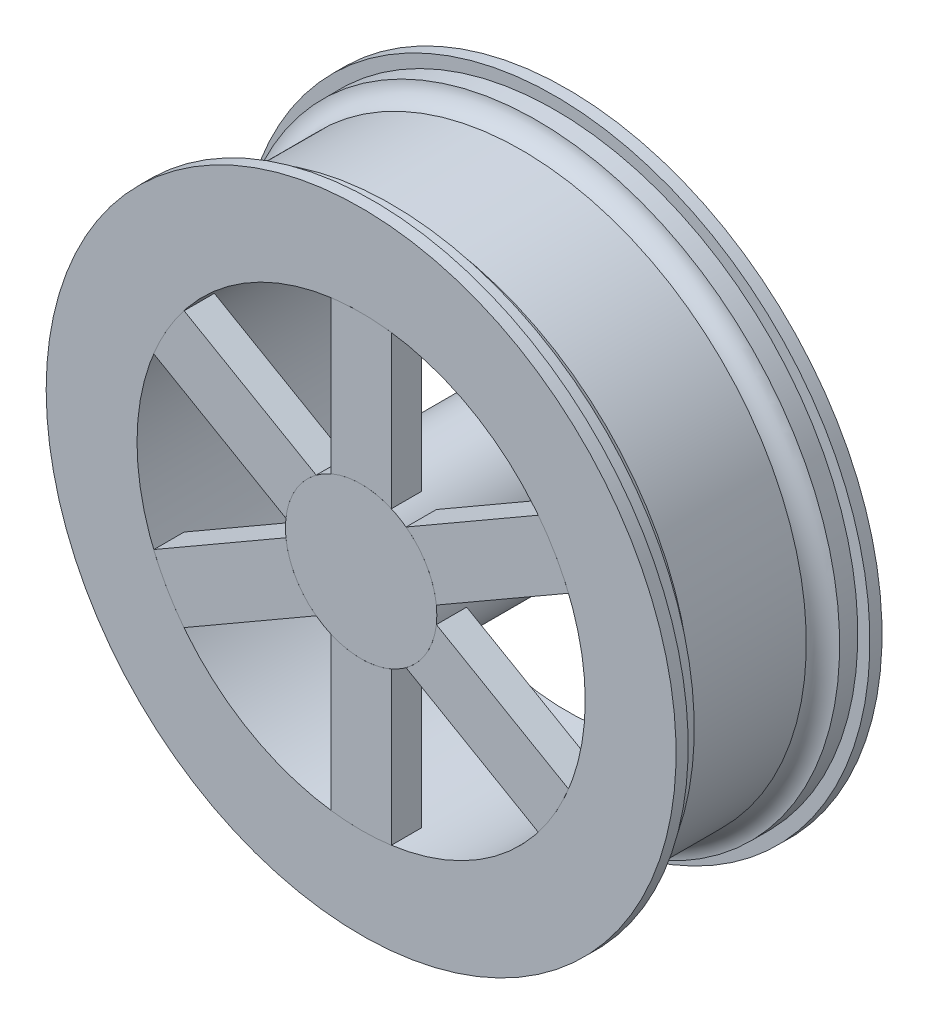
from build123d import *

# Parameters (mm, degrees)
SKETCH2_R             = 12.5
SKETCH2_R_2           = 7.5
BOSS_EXTRUDE1_DEPTH   = 45
BOSS_EXTRUDE6_DEPTH   = 5
BOSS_EXTRUDE6_2_DEPTH = 5
BOSS_EXTRUDE6_3_DEPTH = 5
BOSS_EXTRUDE6_4_DEPTH = 5
BOSS_EXTRUDE6_5_DEPTH = 5
BOSS_EXTRUDE6_6_DEPTH = 5
CUT_EXTRUDE1_DEPTH    = 40


with BuildPart() as part:
    # Sketch1 → Revolve1 (revolve)
    with BuildSketch(Plane(origin=(0, 0, 0), x_dir=(0, 0, -1), z_dir=(1, 0, 0)), mode=Mode.PRIVATE) as revolve1_sk:
        with BuildLine():
            Line((5, 50), (2, 50))
            Line((2, 50), (2, 52))
            Line((2, 52), (0, 52))
            Line((0, 52), (0, 37))
            Line((0, 37), (17, 37))
            Line((17, 37), (17, 47))
            Line((17, 47), (7.5, 47))
            ThreePointArc((7.5, 47), (5.792706688, 48.11892224), (5, 50))
        make_face()
        with BuildLine():
            Line((26.5, 47), (17, 47))
            Line((17, 47), (17, 37))
            Line((17, 37), (34, 37))
            Line((34, 37), (34, 52))
            Line((34, 52), (32, 52))
            Line((32, 52), (32, 50))
            Line((32, 50), (29, 50))
            ThreePointArc((29, 50), (28.207293312, 48.11892224), (26.5, 47))
        make_face()
    revolve(revolve1_sk.sketch.rotate(Axis((0, 0, 0), (0, 0, -1)), 270), axis=Axis((0, 0, 0), (0, 0, -1)))


with BuildPart() as body_2:
    # Sketch2 → Boss-Extrude1 (new body)
    # profile 1 of 2: a face of its own
    with BuildSketch(Plane.XY):
        Circle(SKETCH2_R)
        Circle(SKETCH2_R_2, mode=Mode.SUBTRACT)
    # profile 2 of 2: a face of its own
    with BuildSketch(Plane.XY):
        Circle(SKETCH2_R_2)
    extrude(amount=-BOSS_EXTRUDE1_DEPTH)

    # Sketch4 → Cut-Extrude1 (cut)
    with BuildSketch(Plane(origin=(0, 0, -45), x_dir=(-1, 0, 0), z_dir=(0, 0, -1))):
        with BuildLine():
            Line((-1.52, 1.97), (1.52, 1.97))
            ThreePointArc((1.52, 1.97), (3.49, 0), (1.52, -1.97))
            Line((1.52, -1.97), (-1.52, -1.97))
            ThreePointArc((-1.52, -1.97), (-3.49, 0), (-1.52, 1.97))
        make_face()
    extrude(amount=-CUT_EXTRUDE1_DEPTH, mode=Mode.SUBTRACT)


with BuildPart() as body_3:
    # Sketch3 → Boss-Extrude6 (new body)
    with BuildSketch(Plane.XY):
        with BuildLine():
            Line((-5, 11.456439237), (-5, 36.66060556))
            ThreePointArc((-5, 36.66060556), (0, 37), (5, 36.66060556))
            Line((5, 36.66060556), (5, 11.456439237))
            ThreePointArc((5, 11.456439237), (0, 12.5), (-5, 11.456439237))
        make_face()
    extrude(amount=-BOSS_EXTRUDE6_DEPTH)


with BuildPart() as body_4:
    # Sketch3 → Boss-Extrude6 2 (new body)
    with BuildSketch(Plane.XY):
        with BuildLine():
            Line((12.421567417, 1.3980926), (34.249015733, 14.000175761))
            ThreePointArc((34.249015733, 14.000175761), (32.04293994, 18.5), (29.249015733, 22.660429799))
            Line((29.249015733, 22.660429799), (7.421567417, 10.058346638))
            ThreePointArc((7.421567417, 10.058346638), (10.825317547, 6.25), (12.421567417, 1.3980926))
        make_face()
    extrude(amount=-BOSS_EXTRUDE6_2_DEPTH)


with BuildPart() as body_5:
    # Sketch3 → Boss-Extrude6 3 (new body)
    with BuildSketch(Plane.XY):
        with BuildLine():
            Line((7.421567417, -10.058346638), (29.249015733, -22.660429799))
            ThreePointArc((29.249015733, -22.660429799), (32.04293994, -18.5), (34.249015733, -14.000175761))
            Line((34.249015733, -14.000175761), (12.421567417, -1.3980926))
            ThreePointArc((12.421567417, -1.3980926), (10.825317547, -6.25), (7.421567417, -10.058346638))
        make_face()
    extrude(amount=-BOSS_EXTRUDE6_3_DEPTH)


with BuildPart() as body_6:
    # Sketch3 → Boss-Extrude6 4 (new body)
    with BuildSketch(Plane.XY):
        with BuildLine():
            Line((-5, -11.456439237), (-5, -36.66060556))
            ThreePointArc((-5, -36.66060556), (0, -37), (5, -36.66060556))
            Line((5, -36.66060556), (5, -11.456439237))
            ThreePointArc((5, -11.456439237), (0, -12.5), (-5, -11.456439237))
        make_face()
    extrude(amount=-BOSS_EXTRUDE6_4_DEPTH)


with BuildPart() as body_7:
    # Sketch3 → Boss-Extrude6 5 (new body)
    with BuildSketch(Plane.XY):
        with BuildLine():
            Line((-12.421567417, -1.3980926), (-34.249015733, -14.000175761))
            ThreePointArc((-34.249015733, -14.000175761), (-32.04293994, -18.5), (-29.249015733, -22.660429799))
            Line((-29.249015733, -22.660429799), (-7.421567417, -10.058346638))
            ThreePointArc((-7.421567417, -10.058346638), (-10.825317547, -6.25), (-12.421567417, -1.3980926))
        make_face()
    extrude(amount=-BOSS_EXTRUDE6_5_DEPTH)


with BuildPart() as body_8:
    # Sketch3 → Boss-Extrude6 6 (new body)
    with BuildSketch(Plane.XY):
        with BuildLine():
            Line((-7.421567417, 10.058346638), (-29.249015733, 22.660429799))
            ThreePointArc((-29.249015733, 22.660429799), (-32.04293994, 18.5), (-34.249015733, 14.000175761))
            Line((-34.249015733, 14.000175761), (-12.421567417, 1.3980926))
            ThreePointArc((-12.421567417, 1.3980926), (-10.825317547, 6.25), (-7.421567417, 10.058346638))
        make_face()
    extrude(amount=-BOSS_EXTRUDE6_6_DEPTH)


solid = Compound([part.part, body_2.part, body_3.part, body_4.part, body_5.part, body_6.part, body_7.part, body_8.part])
